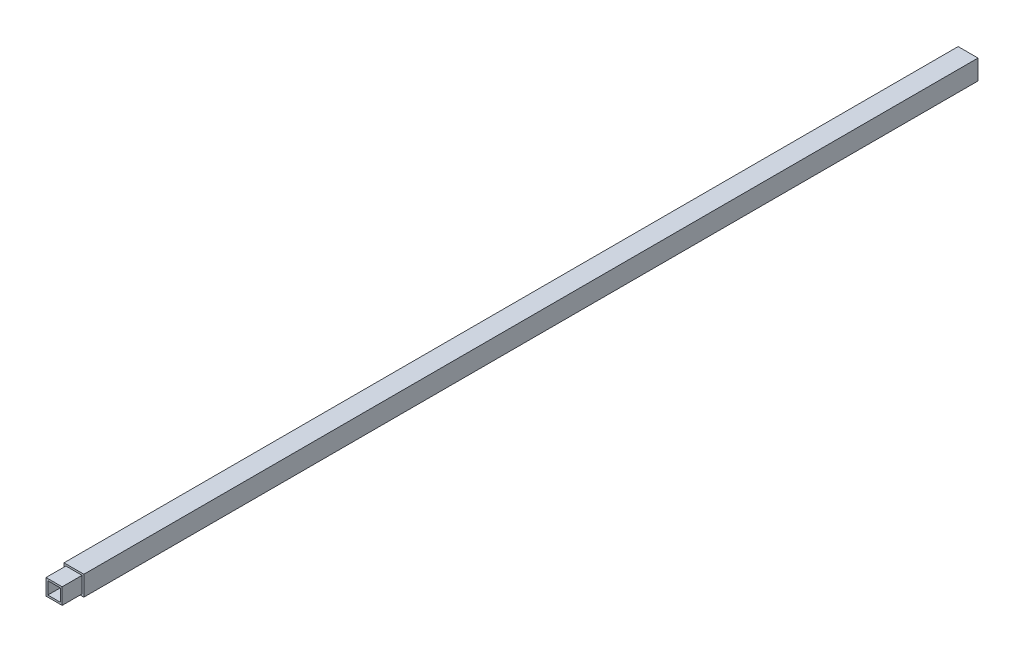
from build123d import *

# Parameters (mm, degrees)
SKETCH1_W           = 50.799956
SKETCH1_H           = 50.799956
SKETCH1_W_2         = 41.274956
SKETCH1_H_2         = 41.274956
BASETUBE_DEPTH      = 1143
BOSS_EXTRUDE2_START = 1143
SKETCH1_3_W         = 41.274956
SKETCH1_3_H         = 41.274956
SKETCH1_3_W_2       = 31.749956
SKETCH1_3_H_2       = 31.749956
BOSS_EXTRUDE2_DEPTH = 50.8


with BuildPart() as part:
    # Sketch1 → BaseTube (new, symmetric)
    with BuildSketch(Plane.XY):
        with Locations((25.399978, 25.399978)):
            Rectangle(SKETCH1_W, SKETCH1_H)
        with Locations((25.399978, 25.399978)):
            Rectangle(SKETCH1_W_2, SKETCH1_H_2, mode=Mode.SUBTRACT)
    extrude(amount=BASETUBE_DEPTH, both=True)

    # Sketch1<3> → Boss-Extrude2 (add, symmetric)
    with BuildSketch(Plane.XY.offset(BOSS_EXTRUDE2_START)):
        with Locations((25.399978, 25.399978)):
            Rectangle(SKETCH1_3_W, SKETCH1_3_H)
        with Locations((25.399978, 25.399978)):
            Rectangle(SKETCH1_3_W_2, SKETCH1_3_H_2, mode=Mode.SUBTRACT)
    extrude(amount=BOSS_EXTRUDE2_DEPTH, both=True)


solid = part.part
